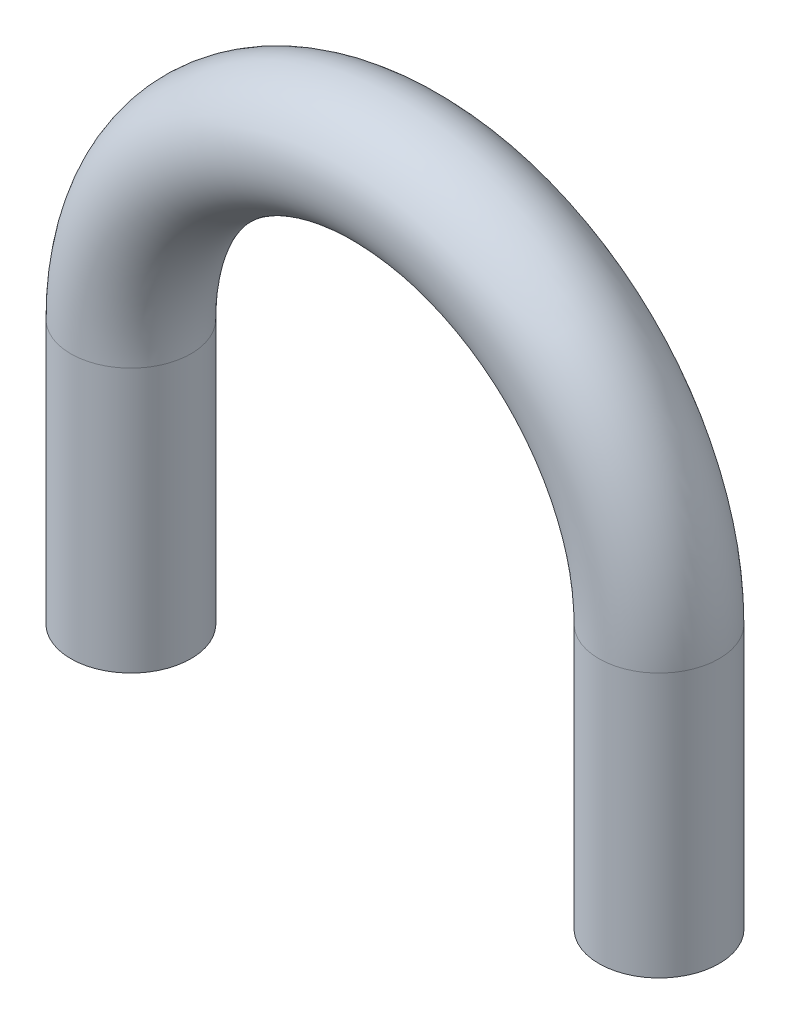
from build123d import *

# Parameters (mm, degrees)
BARRER1_PROFILE_R = 0.455


with BuildPart() as part:
    # Barrer1: sweep along a path in Croquis1
    with BuildLine(Plane.XY) as barrer1_path:
        Line((-2, 0), (-2, 2))
        ThreePointArc((-2, 2), (0, 4), (2, 2))
        Line((2, 2), (2, 0))
    # Barrer1 profile (on start of the path) → Barrer1 (sweep)
    with BuildSketch(Plane(origin=(-2, 0, 0), x_dir=(1, 0, 0), z_dir=(0, 1, 0))):
        Circle(BARRER1_PROFILE_R)
    sweep(path=barrer1_path.line)


solid = part.part
